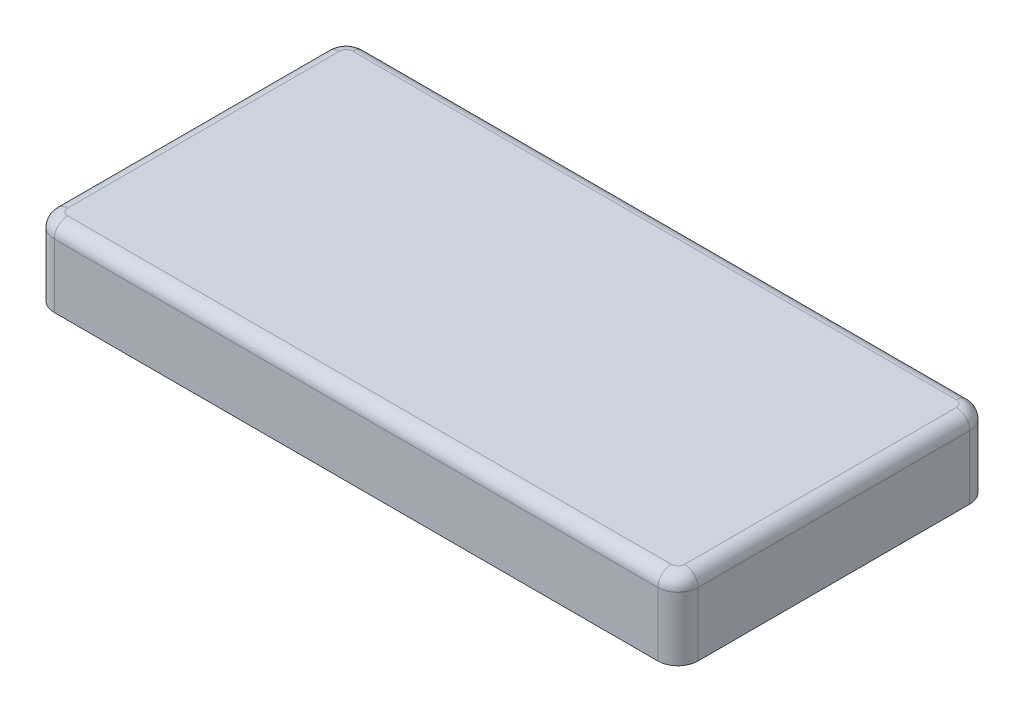
from build123d import *

# Parameters (mm, degrees)
SKETCH1_R             = 3.5
BOSS_EXTRUDE1_DEPTH   = 5
BOSS_EXTRUDE1_2_DEPTH = 5
BOSS_EXTRUDE1_3_DEPTH = 5
BOSS_EXTRUDE1_4_DEPTH = 5
SKETCH2_W             = 96.075
SKETCH2_H             = 46.545
BOSS_EXTRUDE3_DEPTH   = 1.5
SKETCH3_W             = 96.075
SKETCH3_H             = 46.545
SKETCH3_W_2           = 93.075
SKETCH3_H_2           = 43.545
BOSS_EXTRUDE4_DEPTH   = 10
FILLET1_R             = 3
FILLET2_R             = 1.5
FILLET3_R             = 2
FILLET4_R             = 0.5


with BuildPart() as part:
    # Sketch1 → Boss-Extrude1 (new body)
    with BuildSketch(Plane(origin=(0, 1.6, 0), x_dir=(1, 0, 0), z_dir=(0, 1, 0))):
        with Locations(Location((-41.5925, 16.8275, 0), (0, 0, 270))):
            Circle(SKETCH1_R)
    extrude(amount=BOSS_EXTRUDE1_DEPTH)



with BuildPart() as body_2:
    # Sketch1 → Boss-Extrude1 2 (new body)
    with BuildSketch(Plane(origin=(0, 1.6, 0), x_dir=(1, 0, 0), z_dir=(0, 1, 0))):
        with Locations(Location((-41.5925, -16.8275, 0), (0, 0, 270))):
            Circle(SKETCH1_R)
    extrude(amount=BOSS_EXTRUDE1_2_DEPTH)


with BuildPart() as body_3:
    # Sketch1 → Boss-Extrude1 3 (new body)
    with BuildSketch(Plane(origin=(0, 1.6, 0), x_dir=(1, 0, 0), z_dir=(0, 1, 0))):
        with Locations(Location((41.5925, -16.8275, 0), (0, 0, 270))):
            Circle(SKETCH1_R)
    extrude(amount=BOSS_EXTRUDE1_3_DEPTH)


with BuildPart() as body_4:
    # Sketch1 → Boss-Extrude1 4 (new body)
    with BuildSketch(Plane(origin=(0, 1.6, 0), x_dir=(1, 0, 0), z_dir=(0, 1, 0))):
        with Locations(Location((41.5925, 16.8275, 0), (0, 0, 270))):
            Circle(SKETCH1_R)
    extrude(amount=BOSS_EXTRUDE1_4_DEPTH)


with BuildPart() as part_1:
    add(part.part)

    add(body_2.part)  # Boss-Extrude3 merges body 2

    add(body_3.part)  # Boss-Extrude3 merges body 3

    add(body_4.part)  # Boss-Extrude3 merges body 4
    # Sketch2 → Boss-Extrude3 (add)
    with BuildSketch(Plane(origin=(0, 6.6, 0), x_dir=(1, 0, 0), z_dir=(0, 1, 0))):
        Rectangle(SKETCH2_W, SKETCH2_H)
    extrude(amount=-BOSS_EXTRUDE3_DEPTH)

    # Sketch3 → Boss-Extrude4 (add)
    with BuildSketch(Plane.XZ.offset(-5.1)):
        Rectangle(SKETCH3_W, SKETCH3_H)
        Rectangle(SKETCH3_W_2, SKETCH3_H_2, mode=Mode.SUBTRACT)
    extrude(amount=BOSS_EXTRUDE4_DEPTH)

    # Fillet1
    fillet1_edges = [part_1.edges().sort_by_distance(p)[0] for p in [
        (48.0375, 0.85, -23.2725),
        (48.0375, 0.85, 23.2725),
        (-48.0375, 0.85, 23.2725),
        (-48.0375, 0.85, -23.2725),
    ]]
    fillet(fillet1_edges, radius=FILLET1_R)

    # Fillet2
    fillet2_edges = [part_1.edges().sort_by_distance(p)[0] for p in [
        (46.5375, 0.1, -21.7725),
        (46.5375, 0.1, 21.7725),
        (-46.5375, 0.1, 21.7725),
        (-46.5375, 0.1, -21.7725),
    ]]
    fillet(fillet2_edges, radius=FILLET2_R)

    # Fillet3
    fillet3_edges = [part_1.edges().sort_by_distance(p)[0] for p in [
        (48.0375, 6.6, 0),
        (0, 6.6, -23.2725),
        (-48.0375, 6.6, 0),
        (0, 6.6, 23.2725),
        (47.158820344, 6.6, 22.393820344),
        (-47.158820344, 6.6, 22.393820344),
        (-47.158820344, 6.6, -22.393820344),
        (47.158820344, 6.6, -22.393820344),
    ]]
    fillet(fillet3_edges, radius=FILLET3_R)

    # Fillet4
    fillet4_edges = [part_1.edges().sort_by_distance(p)[0] for p in [
        (-46.5375, 5.1, 0),
        (0, 5.1, -21.7725),
        (46.5375, 5.1, 0),
        (0, 5.1, 21.7725),
        (46.098160172, 5.1, 21.333160172),
        (46.098160172, 5.1, -21.333160172),
        (-46.098160172, 5.1, 21.333160172),
        (-46.098160172, 5.1, -21.333160172),
    ]]
    fillet(fillet4_edges, radius=FILLET4_R)


solid = part_1.part
